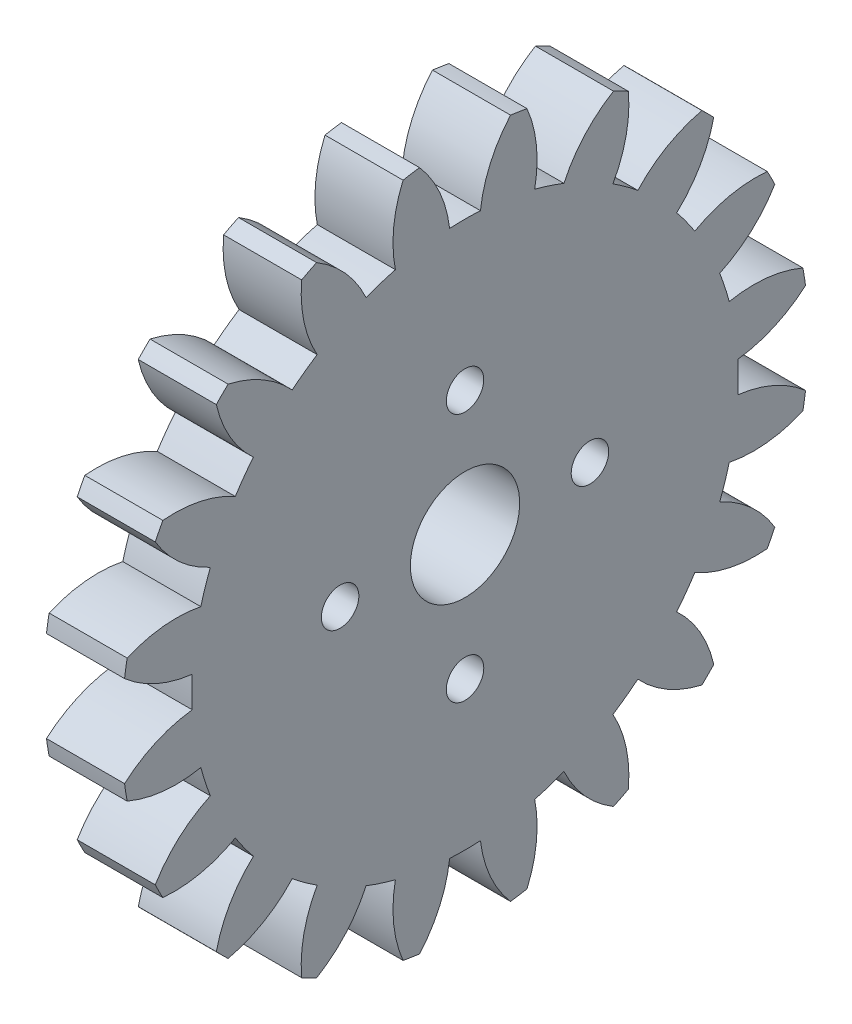
from build123d import *

# Parameters (mm, degrees)
BASPROSKE_W                                    = 5
BASPROSKE_H                                    = 22
TOOTHCUT_DEPTH                                 = 32.511902513
TEETHCUTS_COUNT                                = 20
TEETHCUTS_ANGLE                                = 342
BORSKE_R                                       = 3.5
BORE_DEPTH                                     = 50.0000508
FRAISAGE_POUR_VIS_T_TE_FRAIS_E_M21_D           = 2.4
FRAISAGE_POUR_VIS_T_TE_FRAIS_E_M21_CSINK_D     = 4.4
FRAISAGE_POUR_VIS_T_TE_FRAIS_E_M21_CSINK_ANGLE = 90
R_P_TITION_CIRCULAIRE1_COUNT                   = 4


with BuildPart() as part:
    # BasProSke → Base-Revolve (revolve)
    with BuildSketch(Plane(origin=(0, 0, 0), x_dir=(1, 0, 0), z_dir=(0, 1, 0)), mode=Mode.PRIVATE) as base_revolve_sk:
        with Locations((2.5, 11)):
            Rectangle(BASPROSKE_W, BASPROSKE_H)
    revolve(base_revolve_sk.sketch.rotate(Axis((-10, 0, 0), (1, 0, 0)), 180), axis=Axis((-10, 0, 0), (1, 0, 0)))

    # TooCutSke → ToothCut (cut, through all)
    with BuildSketch(Plane(origin=(0, 0, 0), x_dir=(0, 0, -1), z_dir=(1, 0, 0))):
        with BuildLine():
            ThreePointArc((0.986171591, 17.471189616), (0, 17.499), (-0.986171591, 17.471189616))
            ThreePointArc((-0.986171591, 17.471189616), (-1.626916196, 19.798789858), (-2.932850173, 21.829260982))
            ThreePointArc((-2.932850173, 21.829260982), (0, 22.0254), (2.932850173, 21.829260982))
            ThreePointArc((2.932850173, 21.829260982), (1.626916196, 19.798789858), (0.986171591, 17.471189616))
        make_face()
    toothcut = extrude(amount=TOOTHCUT_DEPTH, mode=Mode.SUBTRACT)

    # TeethCuts: ToothCut ×20 about axis
    teethcuts_axis = Axis((-10, 0, 0), (1, 0, 0))
    for i in range(1, TEETHCUTS_COUNT):
        add(toothcut.rotate(teethcuts_axis, i * TEETHCUTS_ANGLE / (TEETHCUTS_COUNT - 1)), mode=Mode.SUBTRACT)

    # BorSke → Bore (cut, symmetric)
    with BuildSketch(Plane(origin=(0, 0, 0), x_dir=(0, 0, -1), z_dir=(1, 0, 0))):
        with Locations(Location((0, 0, 0), (0, 0, 180))):
            Circle(BORSKE_R)
    extrude(amount=BORE_DEPTH, both=True, mode=Mode.SUBTRACT)

    # Fraisage pour vis à tête fraisée M21 (through all)
    with Locations(Plane.ZY):
        with Locations((0, 8)):
            fraisage_pour_vis_t_te_frais_e_m21 = CounterSinkHole(FRAISAGE_POUR_VIS_T_TE_FRAIS_E_M21_D / 2, FRAISAGE_POUR_VIS_T_TE_FRAIS_E_M21_CSINK_D / 2, counter_sink_angle=FRAISAGE_POUR_VIS_T_TE_FRAIS_E_M21_CSINK_ANGLE)

    # Répétition circulaire1: Fraisage pour vis à tête fraisée M21 ×4 about axis
    r_p_tition_circulaire1_axis = Axis((0, 0, 0), (1, 0, 0))
    for i in range(1, R_P_TITION_CIRCULAIRE1_COUNT):
        add(fraisage_pour_vis_t_te_frais_e_m21.rotate(r_p_tition_circulaire1_axis, i * 360 / R_P_TITION_CIRCULAIRE1_COUNT), mode=Mode.SUBTRACT)


solid = part.part
